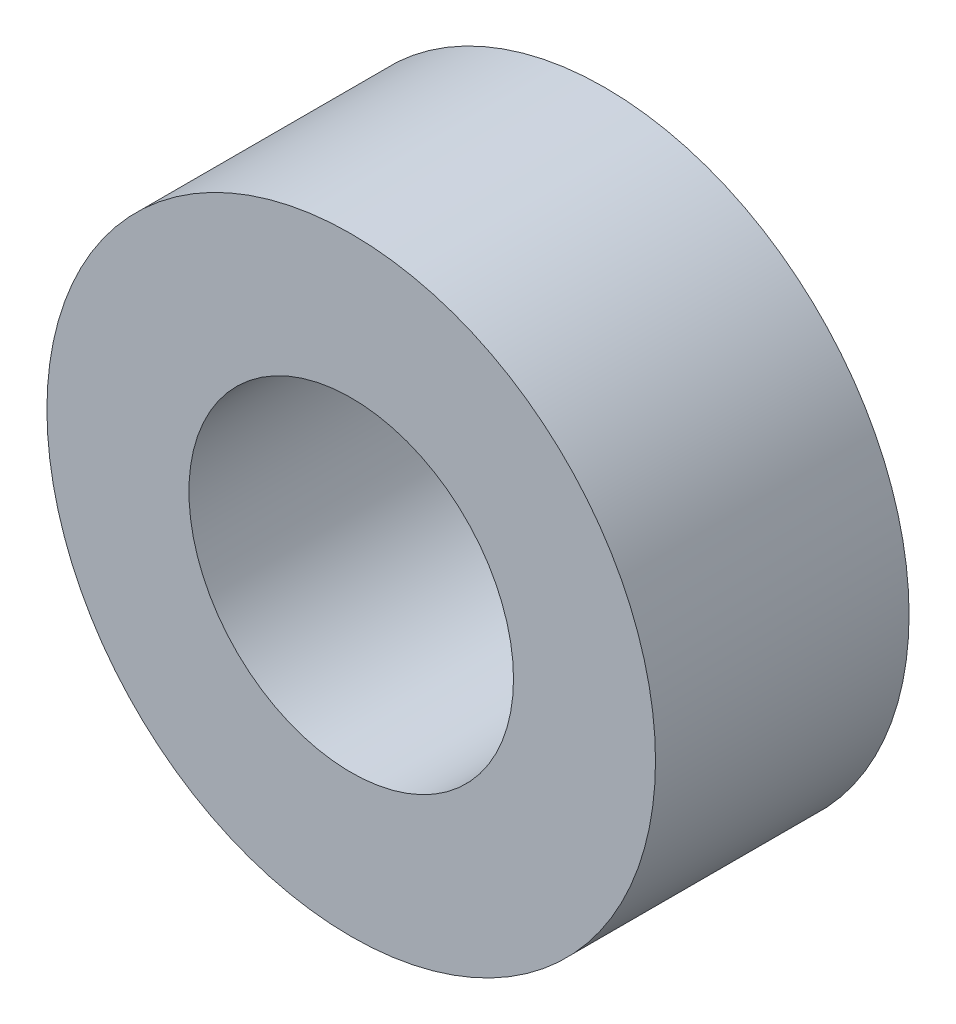
from build123d import *

# Parameters (mm, degrees)
SKETCH_1_R      = 3
SKETCH_1_R_2    = 1.6
EXTRUDE_1_DEPTH = 2.5


with BuildPart() as part:
    # ｽｹｯﾁ1 → ﾎﾞｽ - 押し出し1 (new body)
    with BuildSketch(Plane.XY):
        Circle(SKETCH_1_R)
        Circle(SKETCH_1_R_2, mode=Mode.SUBTRACT)
    extrude(amount=EXTRUDE_1_DEPTH)


solid = part.part
